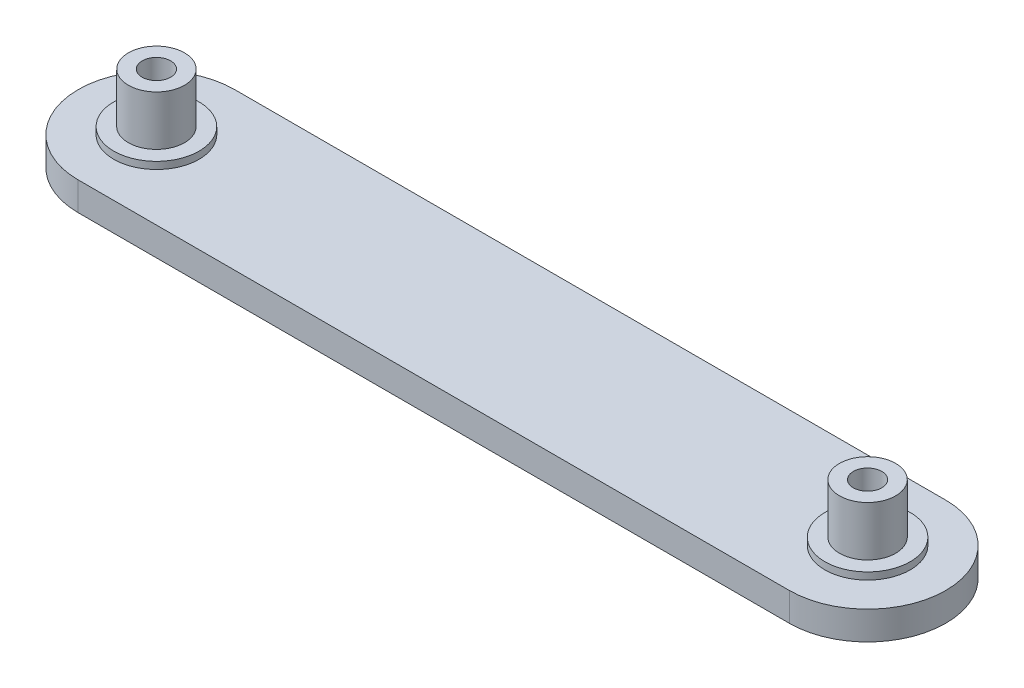
from build123d import *

# Parameters (mm, degrees)
BOSS_EXTRUDE1_DEPTH = 4
SKETCH2_R           = 6
BOSS_EXTRUDE2_DEPTH = 1
SKETCH3_R           = 3.95
BOSS_EXTRUDE3_DEPTH = 7
SKETCH4_R           = 2
CUT_EXTRUDE1_DEPTH  = 113.187343315


with BuildPart() as part:
    # Sketch1 → Boss-Extrude1 (new body)
    with BuildSketch(Plane(origin=(0, 0, 0), x_dir=(1, 0, 0), z_dir=(0, 1, 0))):
        with BuildLine():
            Line((0, 11), (100, 11))
            ThreePointArc((100, 11), (111, 0), (100, -11))
            Line((100, -11), (0, -11))
            ThreePointArc((0, -11), (-11, 0), (0, 11))
        make_face()
    extrude(amount=BOSS_EXTRUDE1_DEPTH)

    # Sketch2 → Boss-Extrude2 (add)
    with BuildSketch(Plane(origin=(0, 4, 0), x_dir=(1, 0, 0), z_dir=(0, 1, 0))):
        with Locations(Location((0, 0, 0), (0, 0, 270))):
            Circle(SKETCH2_R)
        with Locations(Location((100, 0, 0), (0, 0, 270))):
            Circle(SKETCH2_R)
    extrude(amount=BOSS_EXTRUDE2_DEPTH)

    # Sketch3 → Boss-Extrude3 (add)
    with BuildSketch(Plane(origin=(0, 5, 0), x_dir=(1, 0, 0), z_dir=(0, 1, 0))):
        with Locations(Location((0, 0, 0), (0, 0, 270))):
            Circle(SKETCH3_R)
        with Locations(Location((100, 0, 0), (0, 0, 270))):
            Circle(SKETCH3_R)
    extrude(amount=BOSS_EXTRUDE3_DEPTH)

    # Sketch4 → Cut-Extrude1 (cut, through all)
    with BuildSketch(Plane(origin=(0, 12, 0), x_dir=(1, 0, 0), z_dir=(0, 1, 0))):
        with Locations(Location((0, 0, 0), (0, 0, 270))):
            Circle(SKETCH4_R)
        with Locations(Location((100, 0, 0), (0, 0, 270))):
            Circle(SKETCH4_R)
    extrude(amount=-CUT_EXTRUDE1_DEPTH, mode=Mode.SUBTRACT)


solid = part.part
